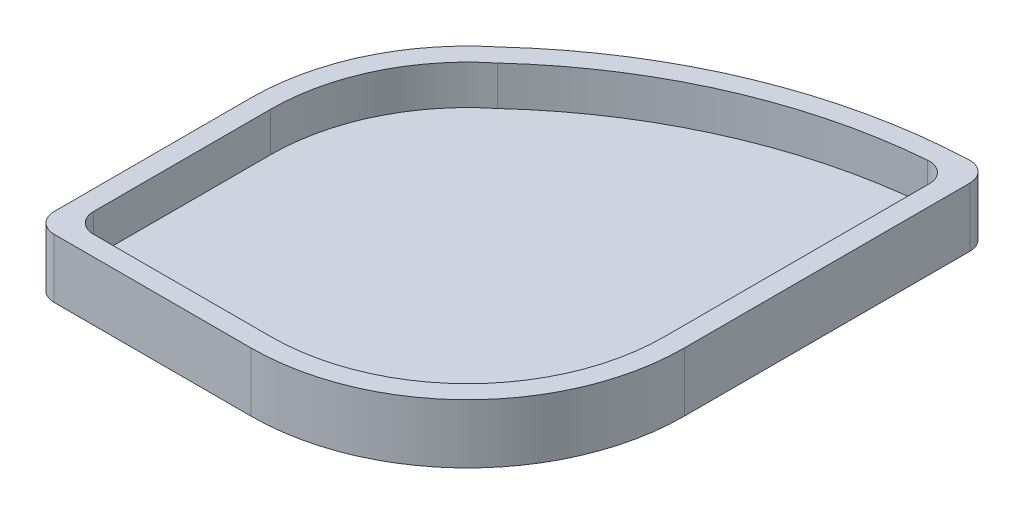
from build123d import *

# Parameters (mm, degrees)
SKETCH_2_R          = 55
EXTRUDE_1_DEPTH     = 15
SKETCH_3_R          = 50
CUT_EXTRUDE_1_DEPTH = 10
EXTRUDE_3_DEPTH     = 15
CUT_EXTRUDE_4_DEPTH = 10
CUT_EXTRUDE_5_DEPTH = 10
FILLET_1_R          = 5
FILLET_2_R          = 5
FILLET_3_R          = 5


with BuildPart() as part:
    # 草圖2 → 填料-伸長1 (new body)
    with BuildSketch(Plane(origin=(0, 0, 0), x_dir=(1, 0, 0), z_dir=(0, 1, 0))):
        with Locations(Location((0, 0, 0), (0, 0, 270))):
            Circle(SKETCH_2_R)
    extrude(amount=EXTRUDE_1_DEPTH)

    # 草圖3 → 除料-伸長1 (cut)
    with BuildSketch(Plane(origin=(0, 15, 0), x_dir=(1, 0, 0), z_dir=(0, 1, 0))):
        with Locations(Location((0, 0, 0), (0, 0, 270))):
            Circle(SKETCH_3_R)
    extrude(amount=-CUT_EXTRUDE_1_DEPTH, mode=Mode.SUBTRACT)

    # 草圖8 → 填料-伸長3 (add)
    with BuildSketch(Plane.XZ):
        with BuildLine():
            ThreePointArc((55, 0), (23.675491822, -49.643439516), (-34.617130436, -42.739376228))
            ThreePointArc((-34.617130436, -42.739376228), (6.919661262, -68.581943503), (55, -77.605489076))
            Line((55, -77.605489076), (55, 0))
        make_face()
        with BuildLine():
            ThreePointArc((-55, 0), (-38.890872965, 38.890872965), (0, 55))
            Line((0, 55), (-55, 55))
            Line((-55, 55), (-55, 0))
        make_face()
    extrude(amount=-EXTRUDE_3_DEPTH)

    # 草圖9 → 除料-伸長4 (cut)
    with BuildSketch(Plane(origin=(0, 15, 0), x_dir=(1, 0, 0), z_dir=(0, 1, 0))):
        with BuildLine():
            ThreePointArc((-31.352560089, 38.948902113), (21.591340805, 45.097827023), (50, 0))
            Line((50, 0), (50, 72.507493279))
            ThreePointArc((50, 72.507493279), (6.339263066, 62.963102381), (-31.352560089, 38.948902113))
        make_face()
    extrude(amount=-CUT_EXTRUDE_4_DEPTH, mode=Mode.SUBTRACT)

    # 草圖10 → 除料-伸長5 (cut)
    with BuildSketch(Plane(origin=(0, 15, 0), x_dir=(1, 0, 0), z_dir=(0, 1, 0))):
        with BuildLine():
            Line((0, -50), (-50, -50))
            Line((-50, -50), (-50, 0))
            ThreePointArc((-50, 0), (-35.355339059, -35.355339059), (0, -50))
        make_face()
    extrude(amount=-CUT_EXTRUDE_5_DEPTH, mode=Mode.SUBTRACT)

    # 圓角1
    fillet_1_edges = [part.edges().sort_by_distance(p)[0] for p in [
        (-50, 10, 50),
    ]]
    fillet(fillet_1_edges, radius=FILLET_1_R)

    # 圓角2
    fillet_2_edges = [part.edges().sort_by_distance(p)[0] for p in [
        (50, 10, -72.507493279),
    ]]
    fillet(fillet_2_edges, radius=FILLET_2_R)

    # 圓角3
    fillet_3_edges = [part.edges().sort_by_distance(p)[0] for p in [
        (55, 7.5, -77.605489076),
        (-55, 7.5, 55),
    ]]
    fillet(fillet_3_edges, radius=FILLET_3_R)


solid = part.part
